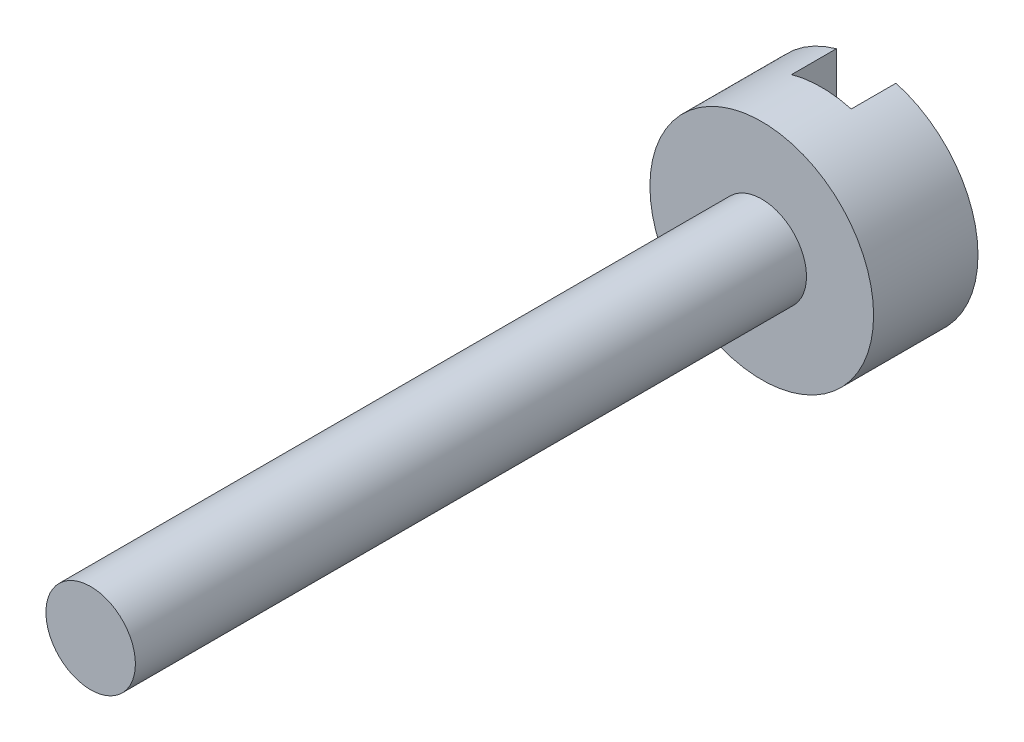
from build123d import *

# Parameters (mm, degrees)
SKETCH1_R           = 0.75
BOSS_EXTRUDE1_DEPTH = 0.7
SKETCH3_R           = 0.3
BOSS_EXTRUDE2_DEPTH = 4.5
SKETCH5_W           = 0.4
SKETCH5_H           = 2
CUT_EXTRUDE1_DEPTH  = 0.3


with BuildPart() as part:
    # Sketch1 → Boss-Extrude1 (new body)
    with BuildSketch(Plane.XY):
        Circle(SKETCH1_R)
    extrude(amount=BOSS_EXTRUDE1_DEPTH)

    # Sketch3 → Boss-Extrude2 (add)
    with BuildSketch(Plane.XY.offset(0.7)):
        Circle(SKETCH3_R)
    extrude(amount=BOSS_EXTRUDE2_DEPTH)

    # Sketch5 → Cut-Extrude1 (cut)
    with BuildSketch(Plane(origin=(0, 0, 0), x_dir=(-1, 0, 0), z_dir=(0, 0, -1))):
        Rectangle(SKETCH5_W, SKETCH5_H)
    extrude(amount=-CUT_EXTRUDE1_DEPTH, mode=Mode.SUBTRACT)


solid = part.part
